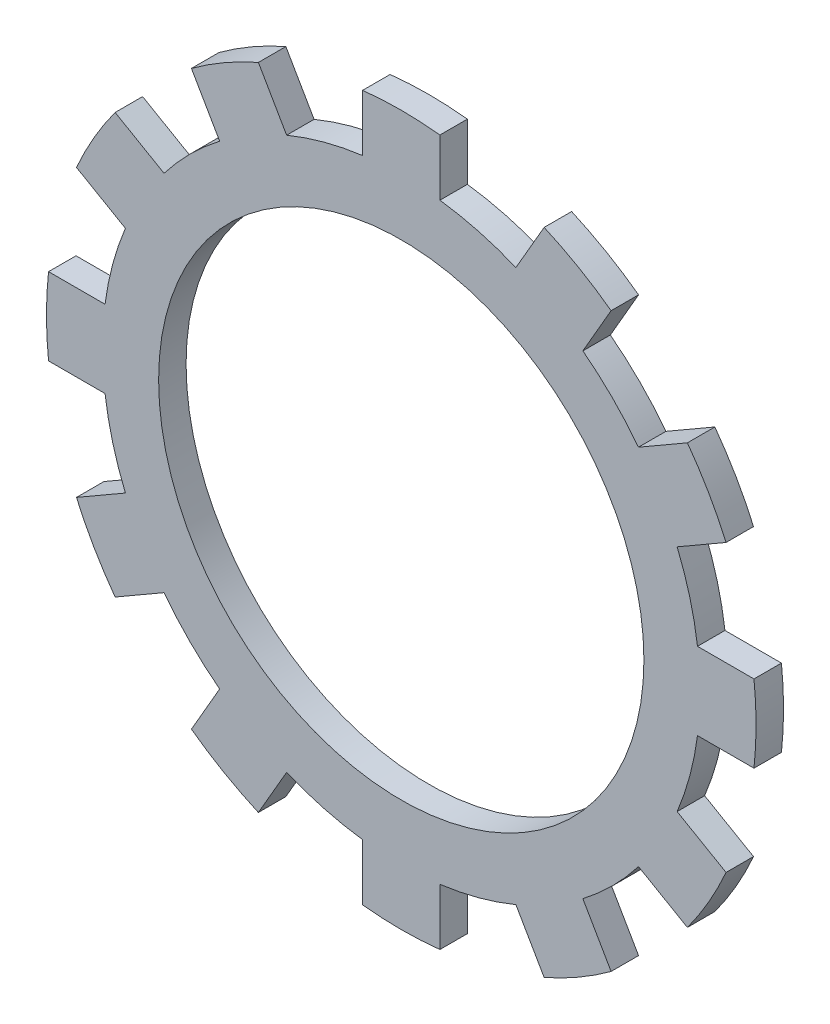
from build123d import *

# Parameters (mm, degrees)
SKETCH1_R         = 13.05
SKETCH1_R_2       = 10.6
EXTRUDE1_DEPTH    = 1.2
EXTRUDE2_DEPTH    = 1.2
CIRPATTERN1_COUNT = 12


with BuildPart() as part:
    # Sketch1 → Extrude1 (new body)
    with BuildSketch(Plane.XY):
        Circle(SKETCH1_R)
        Circle(SKETCH1_R_2, mode=Mode.SUBTRACT)
    extrude(amount=EXTRUDE1_DEPTH)

    # Sketch2 → Extrude2 (add)
    with BuildSketch(Plane.XY):
        with BuildLine():
            Line((-1.688794269, 15.407724489), (-1.688794269, 12.940265605))
            Line((-1.688794269, 12.940265605), (1.688794269, 12.940265605))
            Line((1.688794269, 12.940265605), (1.688794269, 15.407724489))
            ThreePointArc((1.688794269, 15.407724489), (0, 15.5), (-1.688794269, 15.407724489))
        make_face()
    extrude2 = extrude(amount=EXTRUDE2_DEPTH)

    # CirPattern1: Extrude2 ×12 about axis
    cirpattern1_axis = Axis((0, 0, 0), (0, 0, 1))
    for i in range(1, CIRPATTERN1_COUNT):
        add(extrude2.rotate(cirpattern1_axis, i * 360 / CIRPATTERN1_COUNT))


solid = part.part
